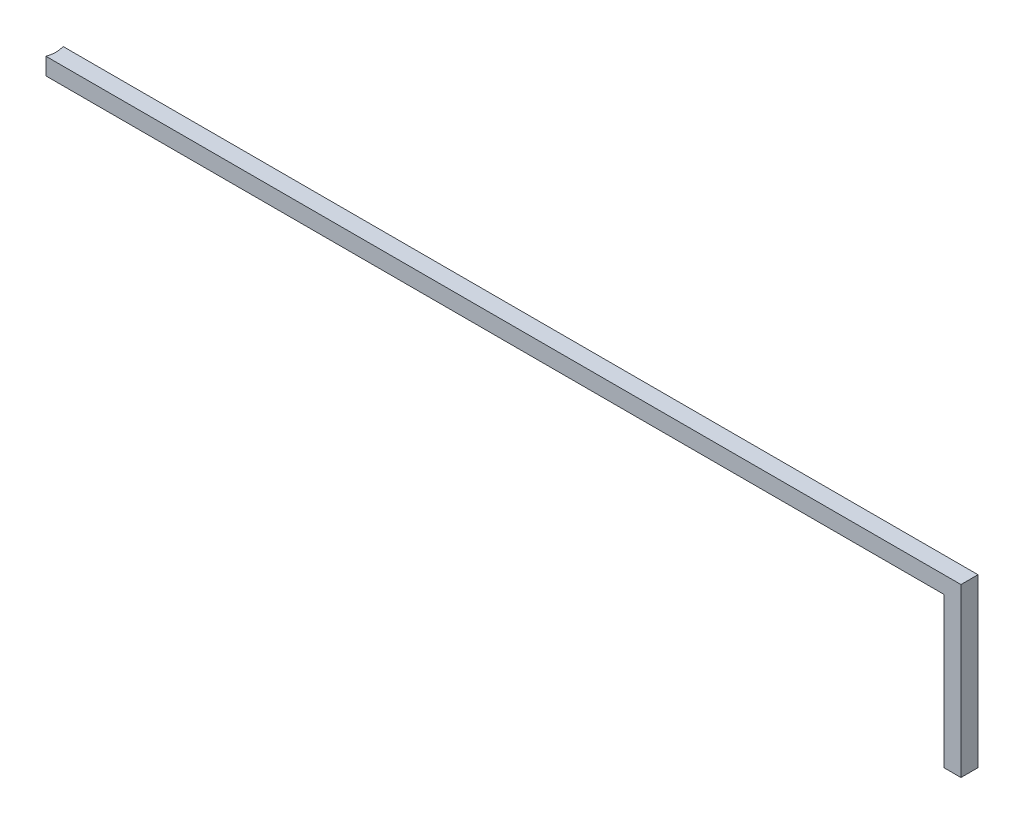
from build123d import *

# Parameters (mm, degrees)
EXTRUDE_1_DEPTH     = 15.5
SKETCH_3_R          = 24
CUT_EXTRUDE_1_DEPTH = 15.5


with BuildPart() as part:
    # 草图2 → 凸台-拉伸1 (new body)
    with BuildSketch(Plane.XY):
        Polygon((77.384529859, -105.37056338), (61.884529859, -105.37056338), (61.884529859, 31.12943662), (-757.0344529, 31.12943662), (-757.0344529, 46.62943662), (77.384529859, 46.62943662), align=None)
    extrude(amount=EXTRUDE_1_DEPTH)

    # 草图3 → 切除-拉伸1 (cut)
    with BuildSketch(Plane(origin=(0, 46.62943662, 0), x_dir=(1, 0, 0), z_dir=(0, 1, 0))):
        with Locations((-777.351299764, -7.75)):
            Circle(SKETCH_3_R)
    extrude(amount=-CUT_EXTRUDE_1_DEPTH, mode=Mode.SUBTRACT)


solid = part.part
